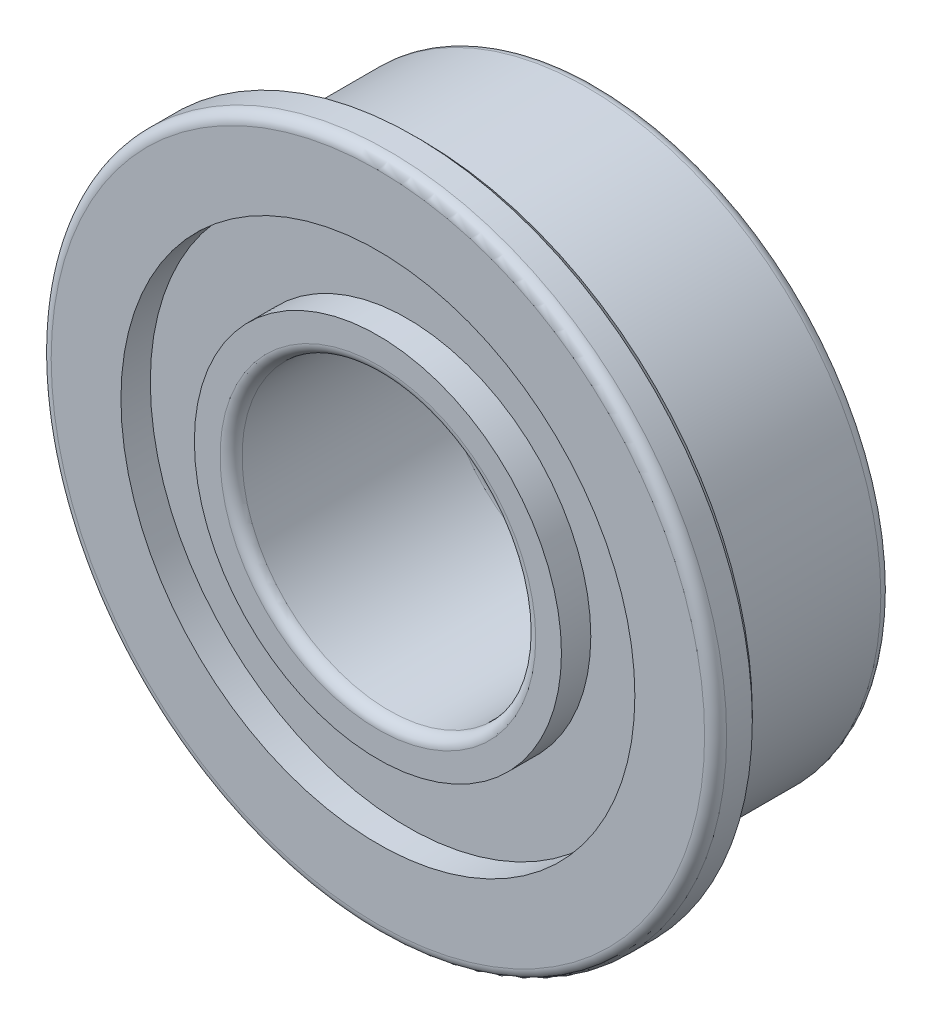
from build123d import *

# Parameters (mm, degrees)
SKETCH1_R           = 4
SKETCH1_R_2         = 2
BOSS_EXTRUDE1_DEPTH = 3
BOSS_EXTRUDE2_START = -0.6
SKETCH2_R           = 4.6
SKETCH2_R_2         = 4
BOSS_EXTRUDE2_DEPTH = 0.6
SKETCH3_R           = 3.5
SKETCH3_R_2         = 2.5
CUT_EXTRUDE1_DEPTH  = 0.2
CUT_EXTRUDE2_START  = -2.6
SKETCH3_2_R         = 3.5
SKETCH3_2_R_2       = 2.5
CUT_EXTRUDE2_DEPTH  = 0.4
FILLET1_R           = 0.15
CHAMFER1_SIZE       = 0.1


with BuildPart() as part:
    # Sketch1 → Boss-Extrude1 (new body)
    with BuildSketch(Plane.XY):
        Circle(SKETCH1_R)
        Circle(SKETCH1_R_2, mode=Mode.SUBTRACT)
    extrude(amount=BOSS_EXTRUDE1_DEPTH)

    # Sketch2 → Boss-Extrude2 (add)
    with BuildSketch(Plane.XY.offset(3).offset(BOSS_EXTRUDE2_START)):
        Circle(SKETCH2_R)
        Circle(SKETCH2_R_2, mode=Mode.SUBTRACT)
    extrude(amount=BOSS_EXTRUDE2_DEPTH)

    # Sketch3 → Cut-Extrude1 (cut)
    with BuildSketch(Plane(origin=(0, 0, 0), x_dir=(-1, 0, 0), z_dir=(0, 0, -1))):
        Circle(SKETCH3_R)
        Circle(SKETCH3_R_2, mode=Mode.SUBTRACT)
    extrude(amount=-CUT_EXTRUDE1_DEPTH, mode=Mode.SUBTRACT)

    # Sketch3<2> → Cut-Extrude2 (cut)
    with BuildSketch(Plane(origin=(0, 0, 0), x_dir=(-1, 0, 0), z_dir=(0, 0, -1)).offset(CUT_EXTRUDE2_START)):
        Circle(SKETCH3_2_R)
        Circle(SKETCH3_2_R_2, mode=Mode.SUBTRACT)
    extrude(amount=-CUT_EXTRUDE2_DEPTH, mode=Mode.SUBTRACT)

    # Fillet1
    fillet1_edges = [part.edges().sort_by_distance(p)[0] for p in [
        (-4.6, 0, 3),
        (2.5, 0, 0),
        (-4, 0, 0),
        (-2, 0, 0),
        (-2, 0, 3),
    ]]
    fillet(fillet1_edges, radius=FILLET1_R)

    # Chamfer1
    chamfer1_edges = [part.edges().sort_by_distance(p)[0] for p in [
        (-4.6, 0, 2.4),
    ]]
    chamfer(chamfer1_edges, length=CHAMFER1_SIZE)


solid = part.part
